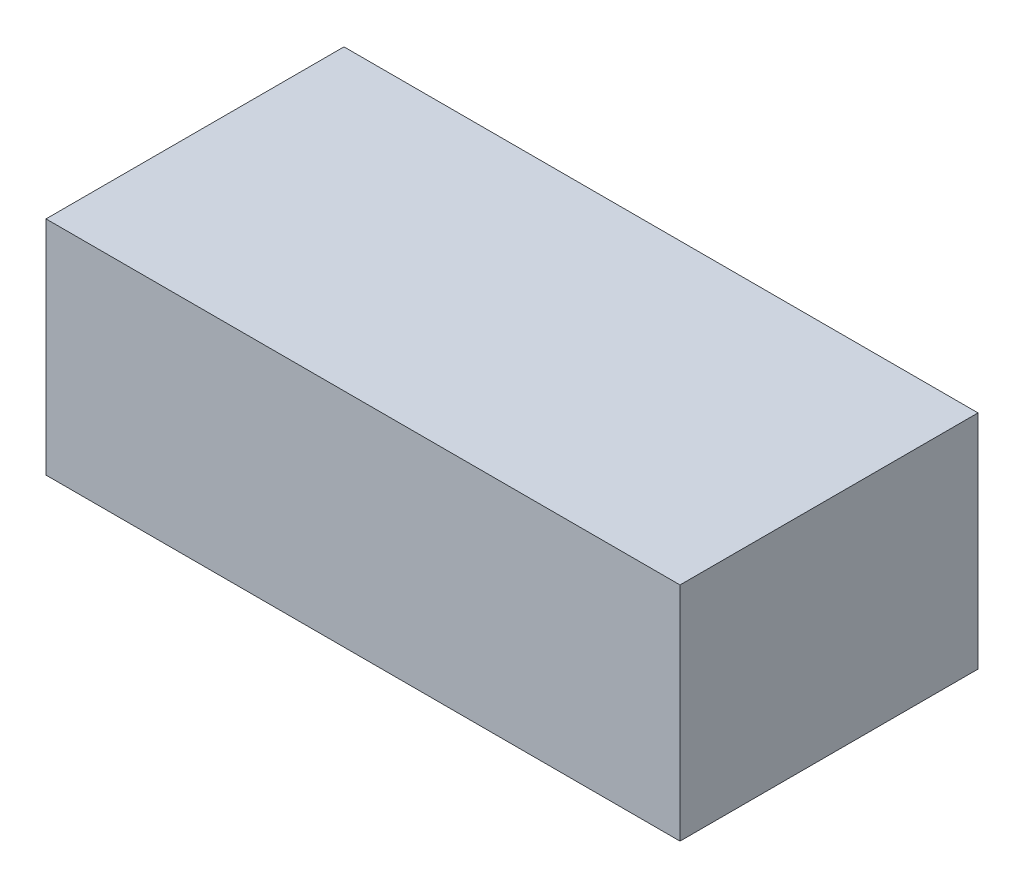
from build123d import *

# Parameters (mm, degrees)
ESQUISSE1_W        = 100
ESQUISSE1_H        = 35
BOSS_EXTRU_1_DEPTH = 47


with BuildPart() as part:
    # Esquisse1 → Boss.-Extru.1 (new body)
    with BuildSketch(Plane.XY):
        with Locations((15, 7.87037037)):
            Rectangle(ESQUISSE1_W, ESQUISSE1_H)
    extrude(amount=BOSS_EXTRU_1_DEPTH)


solid = part.part
